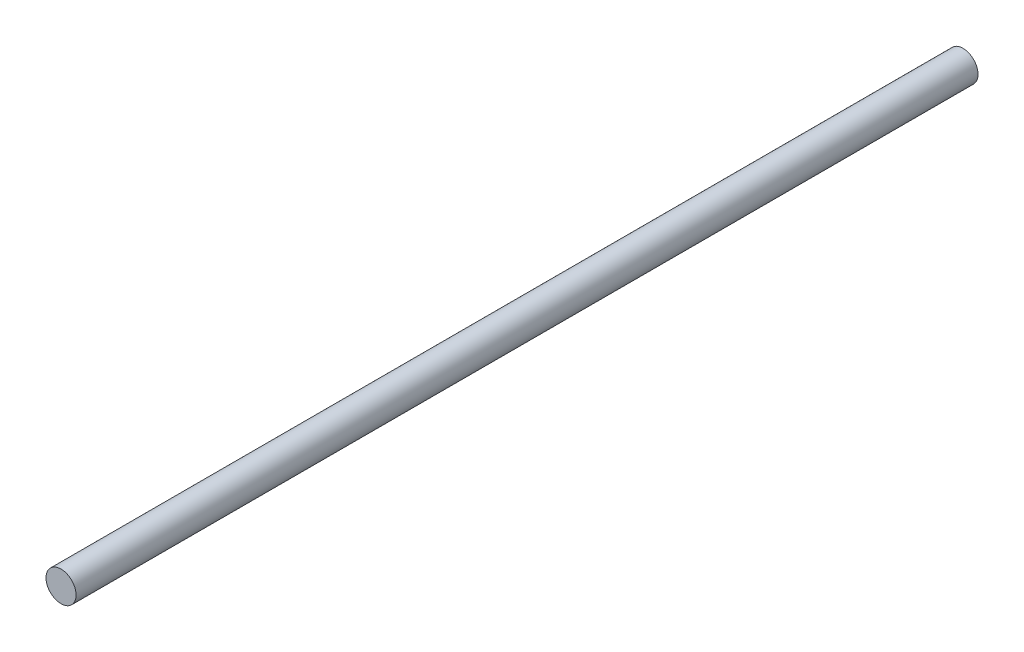
from build123d import *

# Parameters (mm, degrees)
SKETCH1_R           = 3.175
BOSS_EXTRUDE1_DEPTH = 190.5


with BuildPart() as part:
    # Sketch1 → Boss-Extrude1 (new body)
    with BuildSketch(Plane.XY):
        with Locations(Location((0, 0, 0), (0, 0, 180))):
            Circle(SKETCH1_R)
    extrude(amount=BOSS_EXTRUDE1_DEPTH)


solid = part.part
